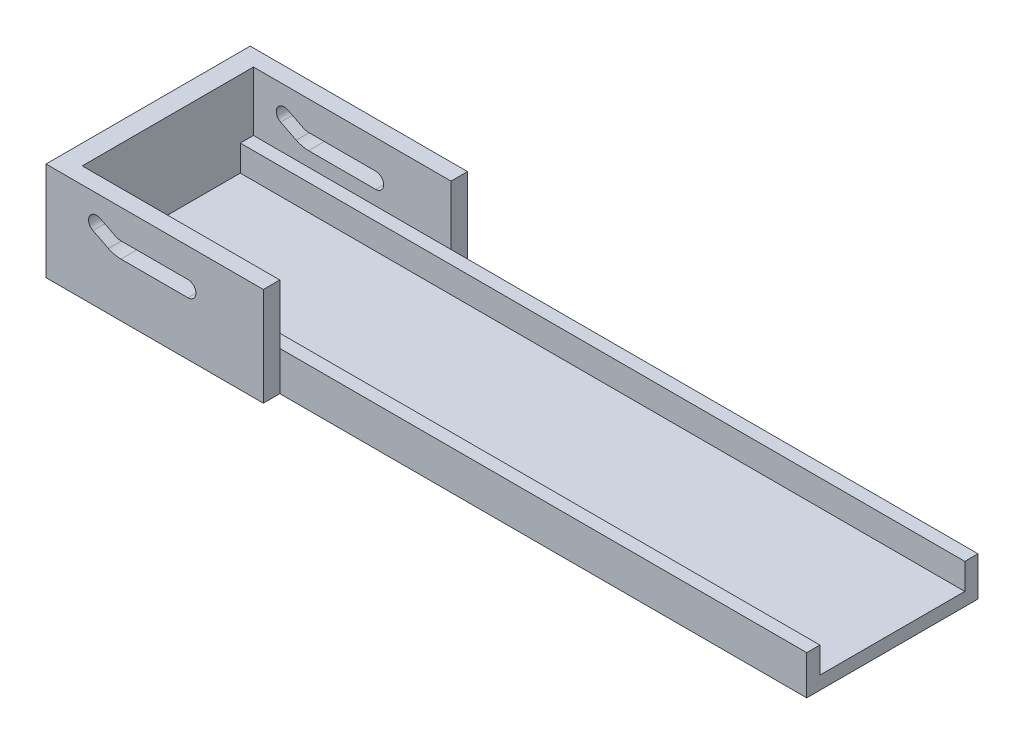
from build123d import *

# Parameters (mm, degrees)
SKETCH_1_W               = 26
SKETCH_1_H               = 11.9
SKETCH_1_W_2             = 22
SKETCH_1_H_2             = 7.9
EXTRUDE_1_DEPTH          = 110
SKETCH_3_W               = 151.071145041
SKETCH_3_H               = 8.521608695
CUT_EXTRUDE_1_DEPTH      = 50
SKETCH_4_W               = 2.5
SKETCH_4_H               = 14.950427865
EXTRUDE_2_DEPTH          = 30
SKETCH_5_W               = 31
SKETCH_5_H               = 14.950427865
EXTRUDE_3_DEPTH          = 3
CUT_EXTRUDE_2_DEPTH      = 114.987971742
CUT_EXTRUDE_2_DEPTH_BACK = 10


with BuildPart() as part:
    # 草图1 → 凸台-拉伸1 (new body)
    with BuildSketch(Plane(origin=(0, 0, 0), x_dir=(0, 0, -1), z_dir=(1, 0, 0))):
        Rectangle(SKETCH_1_W, SKETCH_1_H)
        Rectangle(SKETCH_1_W_2, SKETCH_1_H_2, mode=Mode.SUBTRACT)
    extrude(amount=EXTRUDE_1_DEPTH)

    # 草图3 → 切除-拉伸1 (cut)
    with BuildSketch(Plane.XY.offset(13)):
        with Locations((72.322087123, 4.260804348)):
            Rectangle(SKETCH_3_W, SKETCH_3_H)
    extrude(amount=-CUT_EXTRUDE_1_DEPTH, mode=Mode.SUBTRACT)

    # 草图4 → 凸台-拉伸2 (add)
    with BuildSketch(Plane.ZY):
        with Locations((14.25, 1.525213933)):
            Rectangle(SKETCH_4_W, SKETCH_4_H)
        with Locations((-14.25, 1.525213933)):
            Rectangle(SKETCH_4_W, SKETCH_4_H)
    extrude(amount=-EXTRUDE_2_DEPTH)

    # 草图5 → 凸台-拉伸3 (add)
    with BuildSketch(Plane.ZY):
        with Locations((0, 1.525213933)):
            Rectangle(SKETCH_5_W, SKETCH_5_H)
    extrude(amount=EXTRUDE_3_DEPTH)

    # 草图6 → 切除-拉伸2 (cut, two sides: drawn at the far end of the back side and taken through both)
    with BuildSketch(Plane.XY.offset(-13).offset(-CUT_EXTRUDE_2_DEPTH_BACK)):
        with BuildLine():
            Line((18.563166245, 4.587279606), (12.192847179, 4.587279606))
            ThreePointArc((12.192847179, 4.587279606), (10.632355173, 2.837216293), (8.379481629, 2.187279606))
            Line((8.379481629, 2.187279606), (18.563166245, 2.187279606))
            ThreePointArc((18.563166245, 2.187279606), (19.763166245, 3.387279606), (18.563166245, 4.587279606))
        make_face()
        with BuildLine():
            Line((8.379481629, 4.587279606), (7.947587552, 4.587279606))
            Line((7.947587552, 4.587279606), (8.200962294, 4.460592236))
            ThreePointArc((8.200962294, 4.460592236), (8.854523462, 3.234366745), (7.912225197, 2.213168853))
            ThreePointArc((7.912225197, 2.213168853), (8.145495077, 2.193756878), (8.379481629, 2.187279606))
            ThreePointArc((8.379481629, 2.187279606), (10.632355173, 2.837216293), (12.192847179, 4.587279606))
            Line((12.192847179, 4.587279606), (8.379481629, 4.587279606))
        make_face()
        with BuildLine():
            Line((7.561289802, 4.780428481), (5.200962294, 5.960592236))
            ThreePointArc((5.200962294, 5.960592236), (4.689059665, 6.087024269), (4.172377695, 5.981814468))
            ThreePointArc((4.172377695, 5.981814468), (4.900896967, 4.01090385), (6.487977015, 2.633803302))
            ThreePointArc((6.487977015, 2.633803302), (6.700157723, 2.534954754), (6.917481998, 2.447995868))
            ThreePointArc((6.917481998, 2.447995868), (6.531358389, 3.782791625), (7.664305979, 4.587279606))
            Line((7.664305979, 4.587279606), (7.947587552, 4.587279606))
            Line((7.947587552, 4.587279606), (7.561289802, 4.780428481))
        make_face()
        with BuildLine():
            ThreePointArc((8.379481629, 4.587279606), (7.959141186, 4.636221447), (7.561289802, 4.780428481))
            Line((7.561289802, 4.780428481), (7.947587552, 4.587279606))
            Line((7.947587552, 4.587279606), (8.379481629, 4.587279606))
        make_face()
        with BuildLine():
            ThreePointArc((6.487977015, 2.633803302), (4.900896967, 4.01090385), (4.172377695, 5.981814468))
            ThreePointArc((4.172377695, 5.981814468), (3.464561317, 4.912033292), (4.127649665, 3.813966977))
            Line((4.127649665, 3.813966977), (6.487977015, 2.633803302))
        make_face()
        with BuildLine():
            Line((8.200962294, 4.460592236), (7.947587552, 4.587279606))
            Line((7.947587552, 4.587279606), (7.664305979, 4.587279606))
            ThreePointArc((7.664305979, 4.587279606), (6.531358389, 3.782791625), (6.917481998, 2.447995868))
            ThreePointArc((6.917481998, 2.447995868), (7.407734146, 2.300423879), (7.912225197, 2.213168853))
            ThreePointArc((7.912225197, 2.213168853), (8.854523462, 3.234366745), (8.200962294, 4.460592236))
        make_face()
    extrude(amount=CUT_EXTRUDE_2_DEPTH + CUT_EXTRUDE_2_DEPTH_BACK, mode=Mode.SUBTRACT)


solid = part.part
